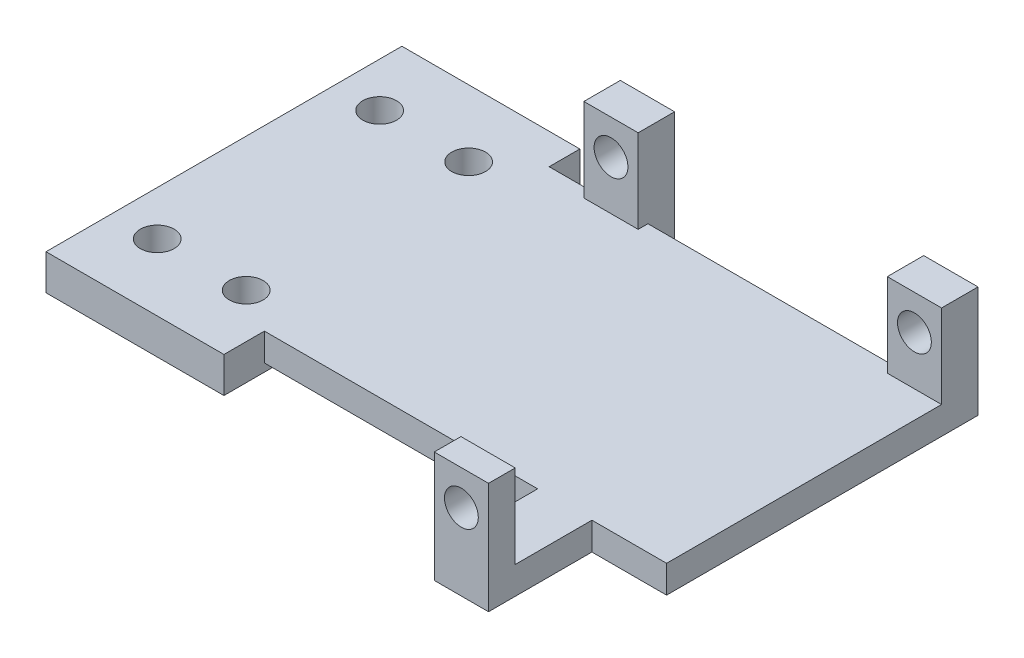
from build123d import *

# Parameters (mm, degrees)
SKETCH2_W           = 75
SKETCH2_H           = 32
BOSS_EXTRUDE2_DEPTH = 3.102863873
SKETCH4_W           = 6.1
SKETCH4_H           = 9.4
SKETCH4_R           = 1.9
BOSS_EXTRUDE4_DEPTH = 1.095
SKETCH7_W           = 14.8
SKETCH7_H           = 32
TRIM_DEPTH          = 69.646631381
SKETCH8_W           = 6.1
SKETCH8_H           = 11.621856523
BOSS_EXTRUDE6_DEPTH = 3.102863873
SKETCH5_W           = 6.1
SKETCH5_H           = 9.4
SKETCH5_R           = 1.9
BOSS_EXTRUDE5_DEPTH = 3
SKETCH9_R           = 1.9
BOSS_EXTRUDE8_DEPTH = 3
SKETCH10_W          = 20
SKETCH10_H          = 40
BOSS_EXTRUDE9_DEPTH = 4
SKETCH11_R          = 1.9
CUT_EXTRUDE2_DEPTH  = 4


with BuildPart() as part:
    # Sketch2 → Boss-Extrude2 (new body)
    with BuildSketch(Plane(origin=(0, -5, 0), x_dir=(-1, 0, 0), z_dir=(0, -1, 0))):
        with Locations((-22.5, 16)):
            Rectangle(SKETCH2_W, SKETCH2_H)
    extrude(amount=-BOSS_EXTRUDE2_DEPTH)

    # Sketch4 → Boss-Extrude4 (add)
    # profile 1 of 2: a face of its own
    with BuildSketch(Plane(origin=(0, 0, -30.905), x_dir=(-1, 0, 0), z_dir=(0, 0, -1))):
        with Locations((-8.05, 2.802863873)):
            Rectangle(SKETCH4_W, SKETCH4_H)
        with Locations((-8.05, 3.602863873)):
            Circle(SKETCH4_R, mode=Mode.SUBTRACT)
    # profile 2 of 2: a face of its own
    with BuildSketch(Plane(origin=(0, 0, -30.905), x_dir=(-1, 0, 0), z_dir=(0, 0, -1))):
        with Locations((-42.15, 2.802863873)):
            Rectangle(SKETCH4_W, SKETCH4_H)
        with Locations(Location((-42.15, 3.602863873, 0), (0, 0, 180))):
            Circle(SKETCH4_R, mode=Mode.SUBTRACT)
    extrude(amount=BOSS_EXTRUDE4_DEPTH)

    # Sketch7 → trim (cut, through all)
    with BuildSketch(Plane(origin=(0, -1.897136127, 0), x_dir=(1, 0, 0), z_dir=(0, 1, 0))):
        with Locations((52.6, 16)):
            Rectangle(SKETCH7_W, SKETCH7_H)
    extrude(amount=-TRIM_DEPTH, mode=Mode.SUBTRACT)

    # Sketch8 → Boss-Extrude6 (add)
    with BuildSketch(Plane(origin=(0, -1.897136127, 0), x_dir=(1, 0, 0), z_dir=(0, 1, 0))):
        with Locations((33.76, -5.810928261)):
            Rectangle(SKETCH8_W, SKETCH8_H)
    extrude(amount=-BOSS_EXTRUDE6_DEPTH)

    # Sketch5 → Boss-Extrude5 (add)
    with BuildSketch(Plane.XY.offset(11.621856523)):
        with Locations((33.76, 2.802863873)):
            Rectangle(SKETCH5_W, SKETCH5_H)
        with Locations((33.76, 3.602863873)):
            Circle(SKETCH5_R, mode=Mode.SUBTRACT)
    extrude(amount=-BOSS_EXTRUDE5_DEPTH)

    # Sketch9 → Boss-Extrude8 (add)
    # profile 1 of 2: a face of its own
    with BuildSketch(Plane(origin=(0, 0, -32), x_dir=(-1, 0, 0), z_dir=(0, 0, -1))):
        Polygon((-45.2, 7.502863873), (-39.1, 7.502863873), (-39.1, -1.897136127), (-39.1, -5), (-45.2, -5), align=None)
        with Locations(Location((-42.15, 3.602863873, 0), (0, 0, 180))):
            Circle(SKETCH9_R, mode=Mode.SUBTRACT)
    # profile 2 of 2: a face of its own
    with BuildSketch(Plane(origin=(0, 0, -32), x_dir=(-1, 0, 0), z_dir=(0, 0, -1))):
        Polygon((-11.1, -1.897136127), (-11.1, 7.502863873), (-5, 7.502863873), (-5, -1.897136127), (-5, -5), (-11.1, -5), align=None)
        with Locations((-8.05, 3.602863873)):
            Circle(SKETCH9_R, mode=Mode.SUBTRACT)
    extrude(amount=BOSS_EXTRUDE8_DEPTH)

    # Sketch10 → Boss-Extrude9 (add)
    with BuildSketch(Plane(origin=(0, -1.897136127, 0), x_dir=(1, 0, 0), z_dir=(0, 1, 0))):
        with Locations((-10, 15.4525)):
            Rectangle(SKETCH10_W, SKETCH10_H)
    extrude(amount=-BOSS_EXTRUDE9_DEPTH)

    # Sketch11 → Cut-Extrude2 (cut)
    with BuildSketch(Plane(origin=(0, -1.897136127, 0), x_dir=(1, 0, 0), z_dir=(0, 1, 0))):
        with Locations(Location((-15, 27.9525, 0), (0, 0, 270))):
            Circle(SKETCH11_R)
        with Locations(Location((-5, 27.9525, 0), (0, 0, 270))):
            Circle(SKETCH11_R)
        with Locations(Location((-15, 2.9525, 0), (0, 0, 270))):
            Circle(SKETCH11_R)
        with Locations(Location((-5, 2.9525, 0), (0, 0, 270))):
            Circle(SKETCH11_R)
    extrude(amount=-CUT_EXTRUDE2_DEPTH, mode=Mode.SUBTRACT)


solid = part.part
